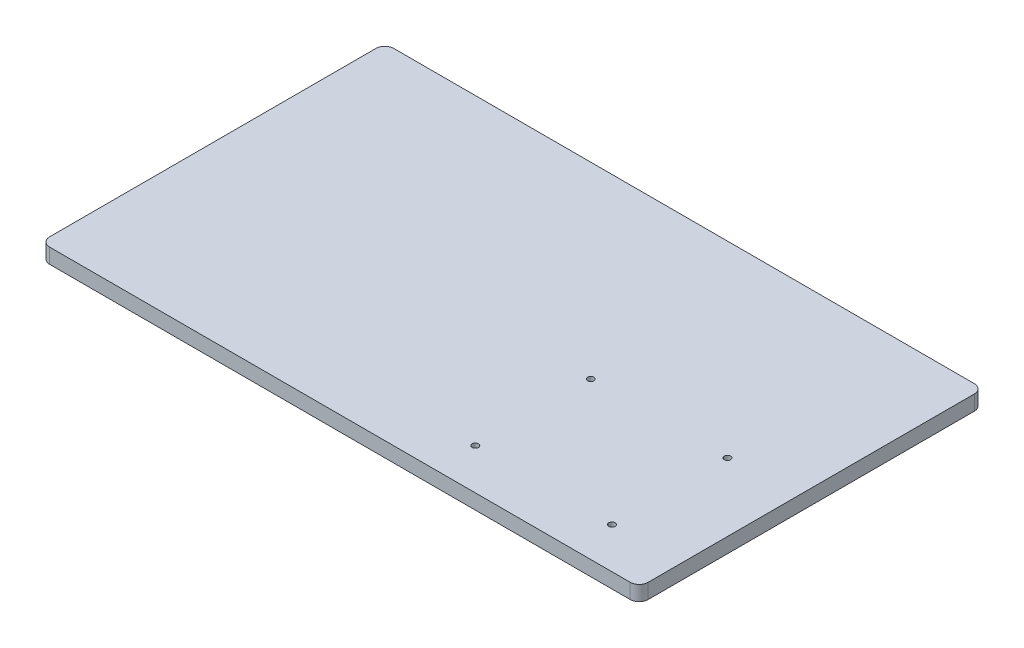
from build123d import *

# Parameters (mm, degrees)
BOSS_EXTRUDE1_DEPTH = 6.35
SKETCH2_R           = 1.35
CUT_EXTRUDE1_DEPTH  = 294.064711284


with BuildPart() as part:
    # Sketch1 → Boss-Extrude1 (new body)
    with BuildSketch(Plane(origin=(0, 0, 0), x_dir=(1, 0, 0), z_dir=(0, 1, 0))):
        with BuildLine():
            Line((3.81, 0), (250.19, 0))
            ThreePointArc((250.19, 0), (252.884076836, 1.115923164), (254, 3.81))
            Line((254, 3.81), (254, 142.24))
            ThreePointArc((254, 142.24), (252.884076836, 144.934076836), (250.19, 146.05))
            Line((250.19, 146.05), (3.81, 146.05))
            ThreePointArc((3.81, 146.05), (1.115923164, 144.934076836), (0, 142.24))
            Line((0, 142.24), (0, 3.81))
            ThreePointArc((0, 3.81), (1.115923164, 1.115923164), (3.81, 0))
        make_face()
    extrude(amount=BOSS_EXTRUDE1_DEPTH)

    # Sketch2 → Cut-Extrude1 (cut, through all)
    with BuildSketch(Plane(origin=(0, 6.35, 0), x_dir=(1, 0, 0), z_dir=(0, 1, 0))):
        with Locations(Location((167.1, 17.35, 0), (0, 0, 270))):
            Circle(SKETCH2_R)
        with Locations(Location((167.1, 66.35, 0), (0, 0, 270))):
            Circle(SKETCH2_R)
        with Locations(Location((225.1, 17.35, 0), (0, 0, 270))):
            Circle(SKETCH2_R)
        with Locations(Location((225.1, 66.35, 0), (0, 0, 270))):
            Circle(SKETCH2_R)
    extrude(amount=-CUT_EXTRUDE1_DEPTH, mode=Mode.SUBTRACT)


solid = part.part
